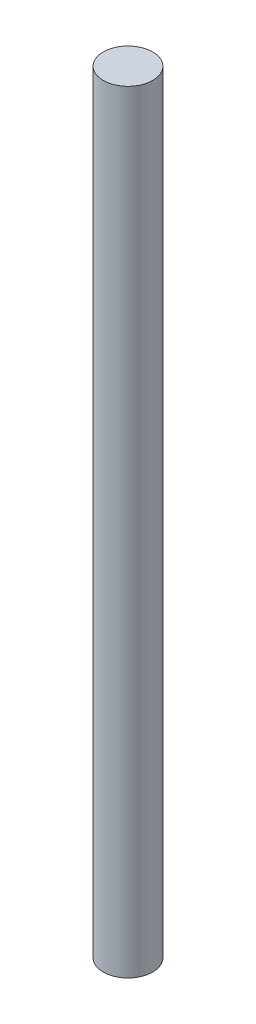
from build123d import *

# Parameters (mm, degrees)
SKETCH1_R           = 4
BOSS_EXTRUDE1_DEPTH = 125


with BuildPart() as part:
    # Sketch1 → Boss-Extrude1 (new body)
    with BuildSketch(Plane(origin=(0, 0, 0), x_dir=(1, 0, 0), z_dir=(0, 1, 0))):
        with Locations(Location((0, 0, 0), (0, 0, 270))):
            Circle(SKETCH1_R)
    extrude(amount=BOSS_EXTRUDE1_DEPTH)


solid = part.part
